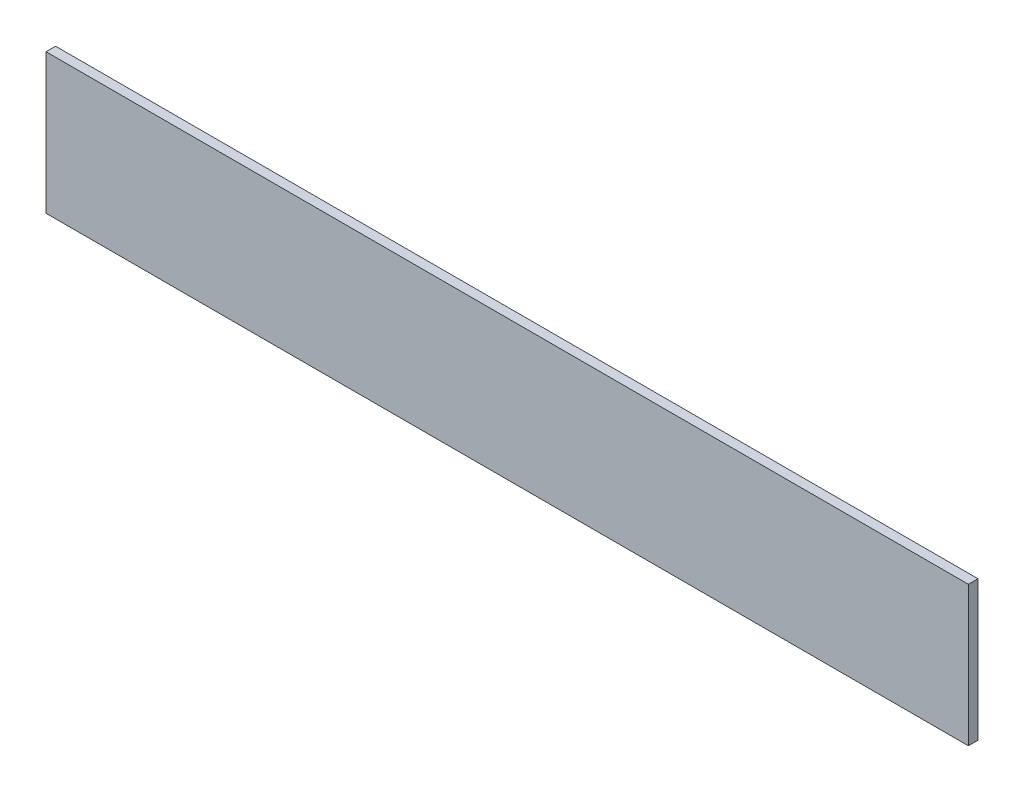
from build123d import *

# Parameters (mm, degrees)
SKETCH1_W           = 1219.2
SKETCH1_H           = 184.912
BOSS_EXTRUDE2_DEPTH = 12.7


with BuildPart() as part:
    # Sketch1 → Boss-Extrude2 (new body)
    with BuildSketch(Plane.XY):
        Rectangle(SKETCH1_W, SKETCH1_H)
    extrude(amount=BOSS_EXTRUDE2_DEPTH)


solid = part.part
